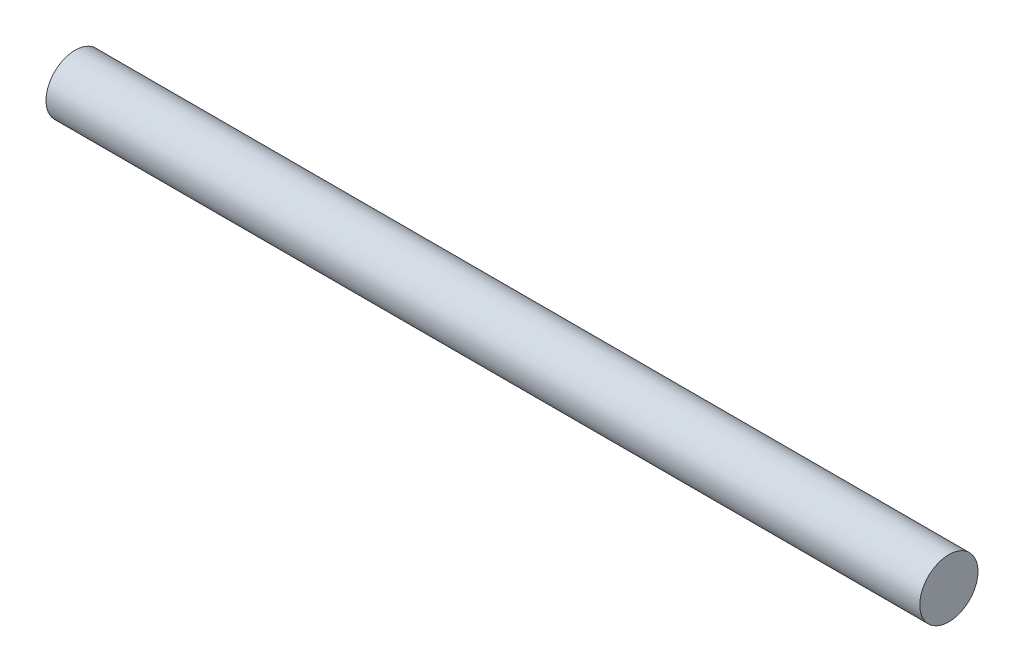
from build123d import *

# Parameters (mm, degrees)
ESQUISSE1_W = 120
ESQUISSE1_H = 4


with BuildPart() as part:
    # Esquisse1 → Révolution1 (revolve)
    with BuildSketch(Plane.XY, mode=Mode.PRIVATE) as r_volution1_sk:
        with Locations((-60, 2)):
            Rectangle(ESQUISSE1_W, ESQUISSE1_H)
    revolve(r_volution1_sk.sketch.rotate(Axis((0, 4, 0), (-1, 0, 0)), 180), axis=Axis((0, 4, 0), (-1, 0, 0)))


solid = part.part
